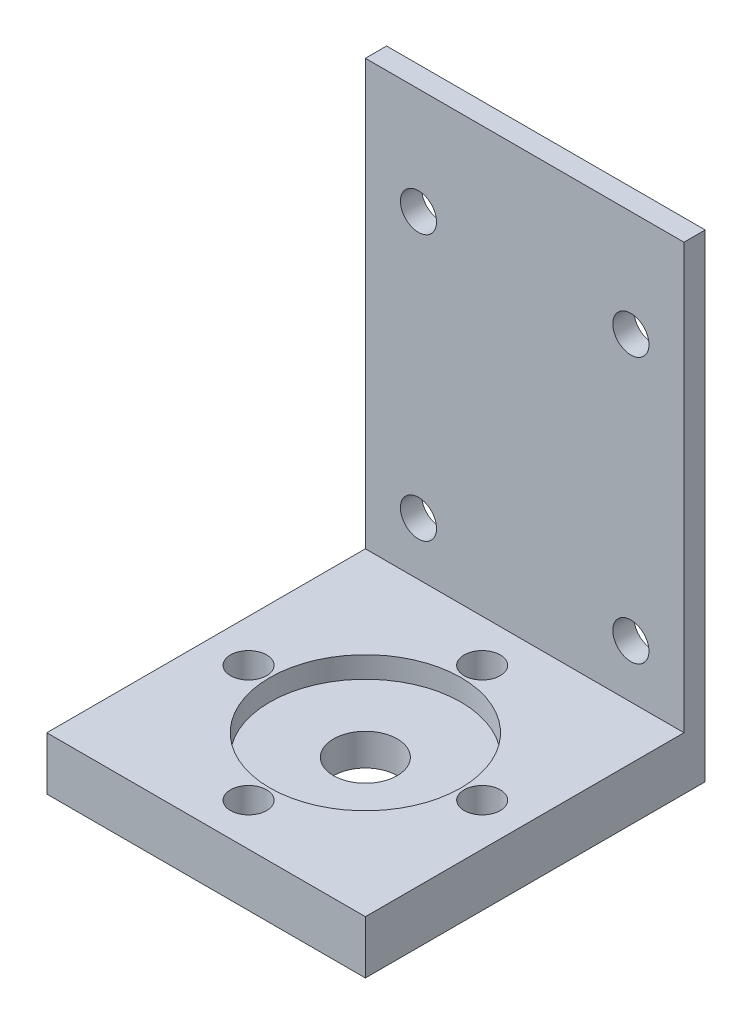
from build123d import *

# Parameters (mm, degrees)
BOSS_EXTRUDE1_DEPTH     = 30
SKETCH3_R               = 9
SKETCH3_R_2             = 3
CUT_EXTRUDE1_DEPTH      = 2
SKETCH7_R               = 3
CUT_EXTRUDE2_DEPTH      = 60.363288319
CUT_EXTRUDE3_DEPTH      = 2
CUT_EXTRUDE3_DEPTH_BACK = 61.728905803
SKETCH8_R               = 1.7
SKETCH9_R               = 1.7
CUT_EXTRUDE4_DEPTH      = 62.846584384


with BuildPart() as part:
    # Sketch2 → Boss-Extrude1 (new body)
    with BuildSketch(Plane(origin=(0, 0, 0), x_dir=(0, 0, -1), z_dir=(1, 0, 0))):
        Polygon((0, 0), (32, 0), (32, 45), (30, 45), (30, 5), (0, 5), align=None)
    extrude(amount=BOSS_EXTRUDE1_DEPTH)

    # Sketch3 → Cut-Extrude1 (cut)
    with BuildSketch(Plane(origin=(0, 5, 0), x_dir=(1, 0, 0), z_dir=(0, 1, 0))):
        with Locations(Location((15, 15, 0), (0, 0, 270))):
            Circle(SKETCH3_R)
        with Locations(Location((15, 15, 0), (0, 0, 270))):
            Circle(SKETCH3_R_2, mode=Mode.SUBTRACT)
    extrude(amount=-CUT_EXTRUDE1_DEPTH, mode=Mode.SUBTRACT)

    # Sketch7 → Cut-Extrude2 (cut, through all)
    with BuildSketch(Plane(origin=(0, 5, 0), x_dir=(1, 0, 0), z_dir=(0, 1, 0))):
        with Locations(Location((15, 15, 0), (0, 0, 270))):
            Circle(SKETCH7_R)
    extrude(amount=-CUT_EXTRUDE2_DEPTH, mode=Mode.SUBTRACT)

    # Sketch8 → Cut-Extrude3 (cut, two sides: drawn at the far end of the back side and taken through both)
    with BuildSketch(Plane(origin=(0, 3, 0), x_dir=(1, 0, 0), z_dir=(0, 1, 0)).offset(-CUT_EXTRUDE3_DEPTH_BACK)):
        with Locations(Location((4, 15, 0), (0, 0, 270))):
            Circle(SKETCH8_R)
        with Locations(Location((26, 15, 0), (0, 0, 270))):
            Circle(SKETCH8_R)
        with Locations(Location((15, 4, 0), (0, 0, 270))):
            Circle(SKETCH8_R)
        with Locations(Location((15, 26, 0), (0, 0, 270))):
            Circle(SKETCH8_R)
    extrude(amount=CUT_EXTRUDE3_DEPTH + CUT_EXTRUDE3_DEPTH_BACK, mode=Mode.SUBTRACT)

    # Sketch9 → Cut-Extrude4 (cut, through all)
    with BuildSketch(Plane.XY.offset(-30)):
        with Locations((5, 35)):
            Circle(SKETCH9_R)
        with Locations((25, 35)):
            Circle(SKETCH9_R)
        with Locations((25, 10)):
            Circle(SKETCH9_R)
        with Locations((5, 10)):
            Circle(SKETCH9_R)
    extrude(amount=-CUT_EXTRUDE4_DEPTH, mode=Mode.SUBTRACT)


solid = part.part
